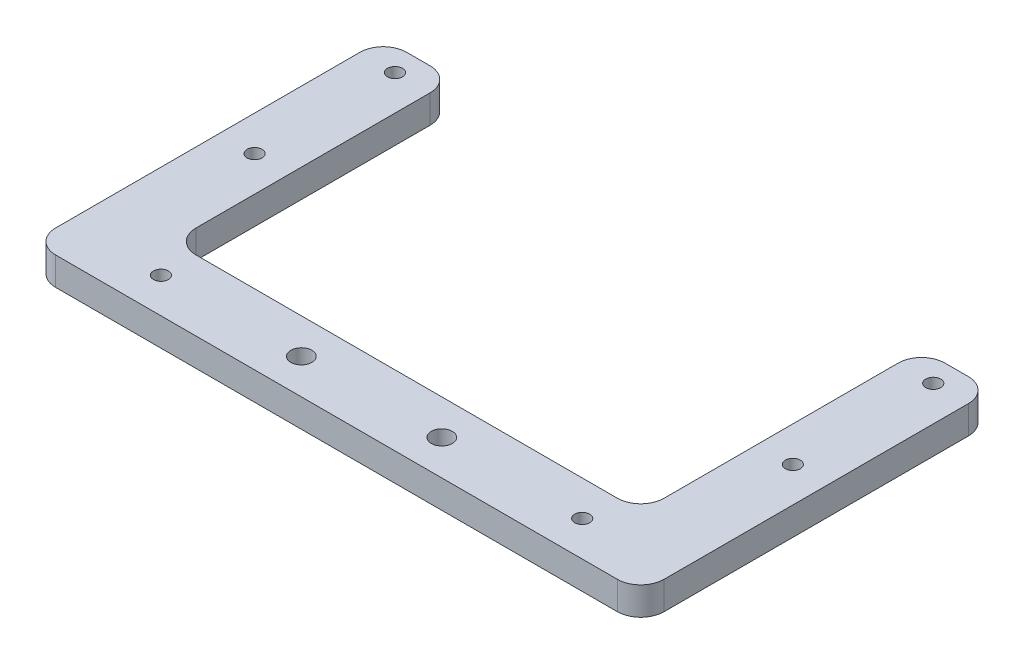
from build123d import *

# Parameters (mm, degrees)
BOSS_EXTRUDE1_DEPTH  = 6
FILLET1_R            = 5
SKETCH2_R            = 2.25
SKETCH2_R_2          = 1.6
CUT_EXTRUDE1_DEPTH   = 89.662280593
FILLET1_OF_MIRROR1_R = 5


with BuildPart() as part:
    # Sketch1 → Boss-Extrude1 (new body)
    with BuildSketch(Plane(origin=(0, 0, 0), x_dir=(1, 0, 0), z_dir=(0, 1, 0))):
        Polygon((0, 0), (-50, 0), (-50, 60), (-65, 60), (-65, -15), (0, -15), align=None)
    boss_extrude1 = extrude(amount=BOSS_EXTRUDE1_DEPTH)

    # Fillet1
    fillet1_edges = [part.edges().sort_by_distance(p)[0] for p in [
        (-65, 3, 15),
        (-65, 3, -60),
        (-50, 3, -60),
        (-50, 3, 0),
    ]]
    fillet(fillet1_edges, radius=FILLET1_R)

    # Sketch2 → Cut-Extrude1 (cut, through all)
    with BuildSketch(Plane(origin=(0, 6, 0), x_dir=(1, 0, 0), z_dir=(0, 1, 0))):
        with Locations(Location((-15, -7.5, 0), (0, 0, 270))):
            Circle(SKETCH2_R)
        with Locations(Location((-45, -7.5, 0), (0, 0, 270))):
            Circle(SKETCH2_R_2)
        with Locations(Location((-57.5, 55, 0), (0, 0, 270))):
            Circle(SKETCH2_R_2)
        with Locations(Location((-57.5, 25, 0), (0, 0, 270))):
            Circle(SKETCH2_R_2)
    cut_extrude1 = extrude(amount=-CUT_EXTRUDE1_DEPTH, mode=Mode.SUBTRACT)

    # Mirror1: Boss-Extrude1, Cut-Extrude1 across plane
    add(boss_extrude1.mirror(Plane(origin=(0, 0, 0), x_dir=(0, 0, 1), z_dir=(1, 0, 0))))
    add(cut_extrude1.mirror(Plane(origin=(0, 0, 0), x_dir=(0, 0, 1), z_dir=(1, 0, 0))), mode=Mode.SUBTRACT)

    # Fillet1 of Mirror1
    fillet1_of_mirror1_edges = [part.edges().sort_by_distance(p)[0] for p in [
        (65, 3, 15),
        (65, 3, -60),
        (50, 3, -60),
        (50, 3, 0),
    ]]
    fillet(fillet1_of_mirror1_edges, radius=FILLET1_OF_MIRROR1_R)


solid = part.part
